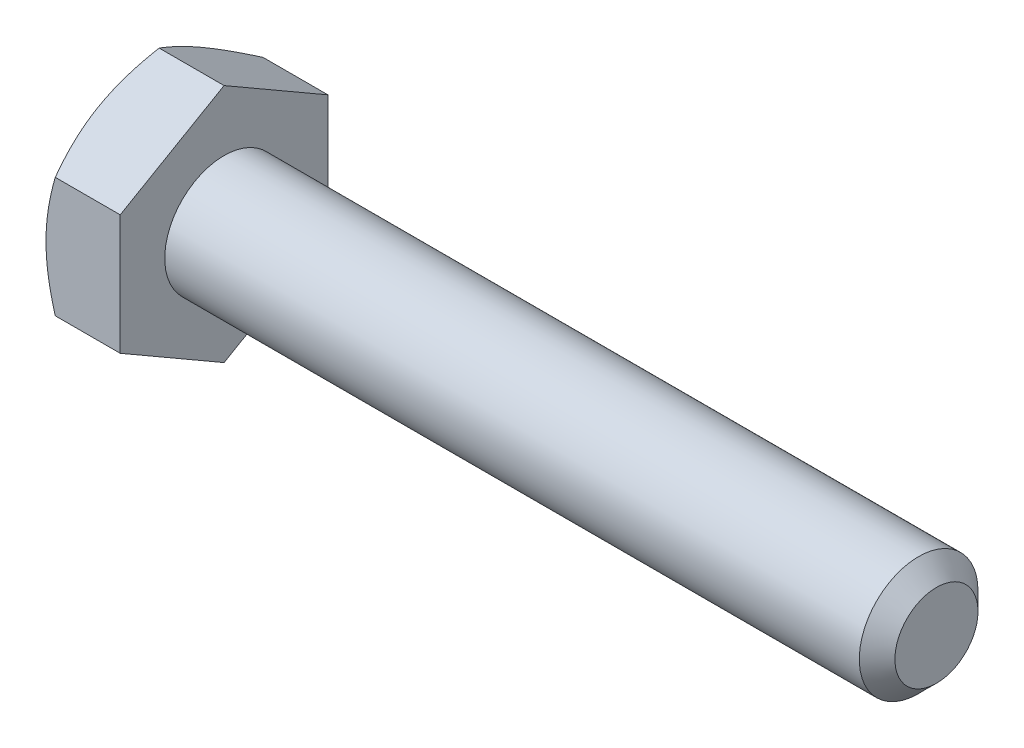
from build123d import *

# Parameters (mm, degrees)
SKETCH5_R           = 3.175
BOSS_EXTRUDE3_DEPTH = 38.1
CHAMFER1_SIZE       = 0.9525
BOSS_EXTRUDE4_DEPTH = 3.96875
SKETCH8_OUTSIDE_W   = 174.316
SKETCH8_OUTSIDE_H   = 176.036
SKETCH8_OUTSIDE_R   = 5.55625
CUT_EXTRUDE3_DEPTH  = 43.916362762
CUT_EXTRUDE3_DRAFT  = -60


with BuildPart() as part:
    # Sketch5 → Boss-Extrude3 (new body)
    with BuildSketch(Plane(origin=(21.034375, 0, 0), x_dir=(0, 0, -1), z_dir=(1, 0, 0))):
        Circle(SKETCH5_R)
    extrude(amount=-BOSS_EXTRUDE3_DEPTH)

    # Chamfer1
    chamfer1_edges = [part.edges().sort_by_distance(p)[0] for p in [
        (21.034375, 0, 3.175),
    ]]
    chamfer(chamfer1_edges, length=CHAMFER1_SIZE)

    # Sketch6 → Boss-Extrude4 (add)
    with BuildSketch(Plane.ZY.offset(17.065625)):
        Polygon((5.55625, 3.207902433), (0, 6.415804866), (-5.55625, 3.207902433), (-5.55625, -3.207902433), (0, -6.415804866), (5.55625, -3.207902433), align=None)
    extrude(amount=BOSS_EXTRUDE4_DEPTH)


with BuildPart() as cut_extrude3_tool:
    # Sketch8 outside → Cut-Extrude3 (with draft: the straight prism first)
    with BuildSketch(Plane.ZY.offset(21.034375)):
        Rectangle(SKETCH8_OUTSIDE_W, SKETCH8_OUTSIDE_H)
        Circle(SKETCH8_OUTSIDE_R, mode=Mode.SUBTRACT)
    extrude(amount=-CUT_EXTRUDE3_DEPTH)
    # Cut-Extrude3: the draft: its side faces are tilted about the plane it starts from
    cut_extrude3_sides = [cut_extrude3_tool.faces().sort_by_distance(p)[0] for p in [
        (0.923806381, -88.018, 0),
        (0.923806381, 0, 87.158),
        (0.923806381, 88.018, 0),
        (0.923806381, 0, -87.158),
        (0.923806381, 0, -5.55625),
    ]]
    draft(cut_extrude3_sides, Plane.ZY.offset(21.034375), CUT_EXTRUDE3_DRAFT)


with BuildPart() as part_1:
    add(part.part)

    # Cut-Extrude3: cut by cut_extrude3_tool
    add(cut_extrude3_tool.part, mode=Mode.SUBTRACT)


solid = part_1.part
